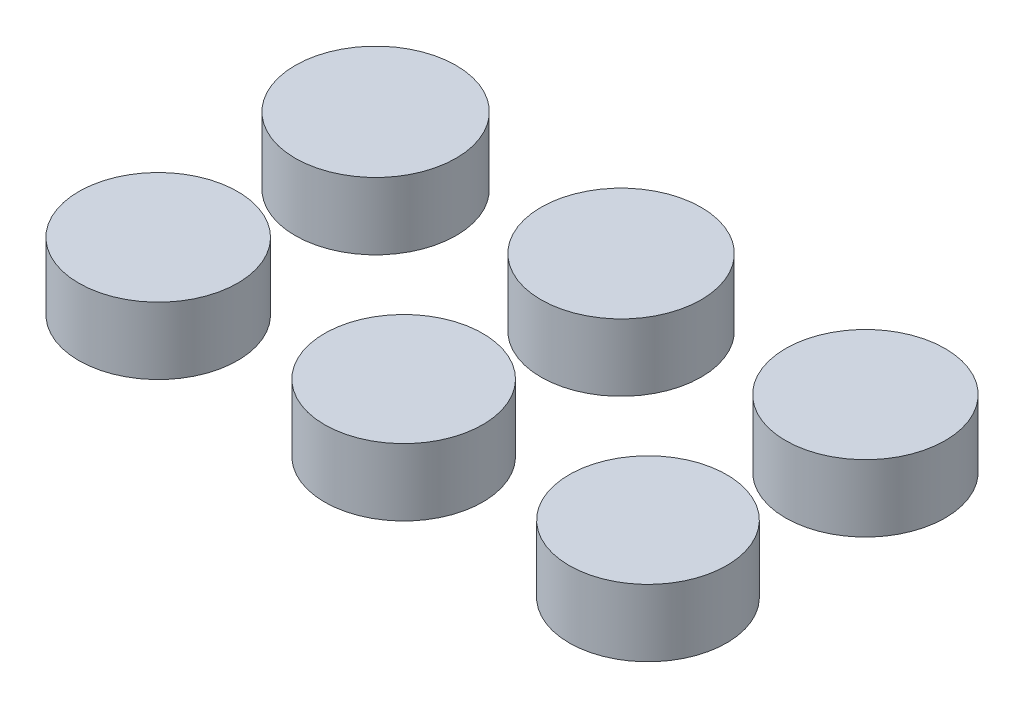
from build123d import *

# Parameters (mm, degrees)
SKETCH1_R             = 6
BOSS_EXTRUDE1_DEPTH   = 5
SKETCH1_R_2           = 5.975
BOSS_EXTRUDE1_2_DEPTH = 5
SKETCH1_R_3           = 5.95
BOSS_EXTRUDE1_3_DEPTH = 5
SKETCH1_R_4           = 5.875
BOSS_EXTRUDE1_4_DEPTH = 5
SKETCH1_R_5           = 5.9
BOSS_EXTRUDE1_5_DEPTH = 5
SKETCH1_R_6           = 5.925
BOSS_EXTRUDE1_6_DEPTH = 5


with BuildPart() as part:
    # Sketch1 → Boss-Extrude1 (new body)
    with BuildSketch(Plane(origin=(0, 0, 0), x_dir=(1, 0, 0), z_dir=(0, 1, 0))):
        with Locations(Location((0, 0, 0), (0, 0, 270))):
            Circle(SKETCH1_R)
    extrude(amount=BOSS_EXTRUDE1_DEPTH)


with BuildPart() as body_2:
    # Sketch1 → Boss-Extrude1 2 (new body)
    with BuildSketch(Plane(origin=(0, 0, 0), x_dir=(1, 0, 0), z_dir=(0, 1, 0))):
        with Locations(Location((18.307451277, 0, 0), (0, 0, 270))):
            Circle(SKETCH1_R_2)
    extrude(amount=BOSS_EXTRUDE1_2_DEPTH)


with BuildPart() as body_3:
    # Sketch1 → Boss-Extrude1 3 (new body)
    with BuildSketch(Plane(origin=(0, 0, 0), x_dir=(1, 0, 0), z_dir=(0, 1, 0))):
        with Locations(Location((36.52898338, 0, 0), (0, 0, 270))):
            Circle(SKETCH1_R_3)
    extrude(amount=BOSS_EXTRUDE1_3_DEPTH)


with BuildPart() as body_4:
    # Sketch1 → Boss-Extrude1 4 (new body)
    with BuildSketch(Plane(origin=(0, 0, 0), x_dir=(1, 0, 0), z_dir=(0, 1, 0))):
        with Locations(Location((36.52898338, -16.217009358, 0), (0, 0, 270))):
            Circle(SKETCH1_R_4)
    extrude(amount=BOSS_EXTRUDE1_4_DEPTH)


with BuildPart() as body_5:
    # Sketch1 → Boss-Extrude1 5 (new body)
    with BuildSketch(Plane(origin=(0, 0, 0), x_dir=(1, 0, 0), z_dir=(0, 1, 0))):
        with Locations(Location((18.307451277, -16.217009358, 0), (0, 0, 270))):
            Circle(SKETCH1_R_5)
    extrude(amount=BOSS_EXTRUDE1_5_DEPTH)


with BuildPart() as body_6:
    # Sketch1 → Boss-Extrude1 6 (new body)
    with BuildSketch(Plane(origin=(0, 0, 0), x_dir=(1, 0, 0), z_dir=(0, 1, 0))):
        with Locations(Location((0, -16.217009358, 0), (0, 0, 270))):
            Circle(SKETCH1_R_6)
    extrude(amount=BOSS_EXTRUDE1_6_DEPTH)


solid = Compound([part.part, body_2.part, body_3.part, body_4.part, body_5.part, body_6.part])
